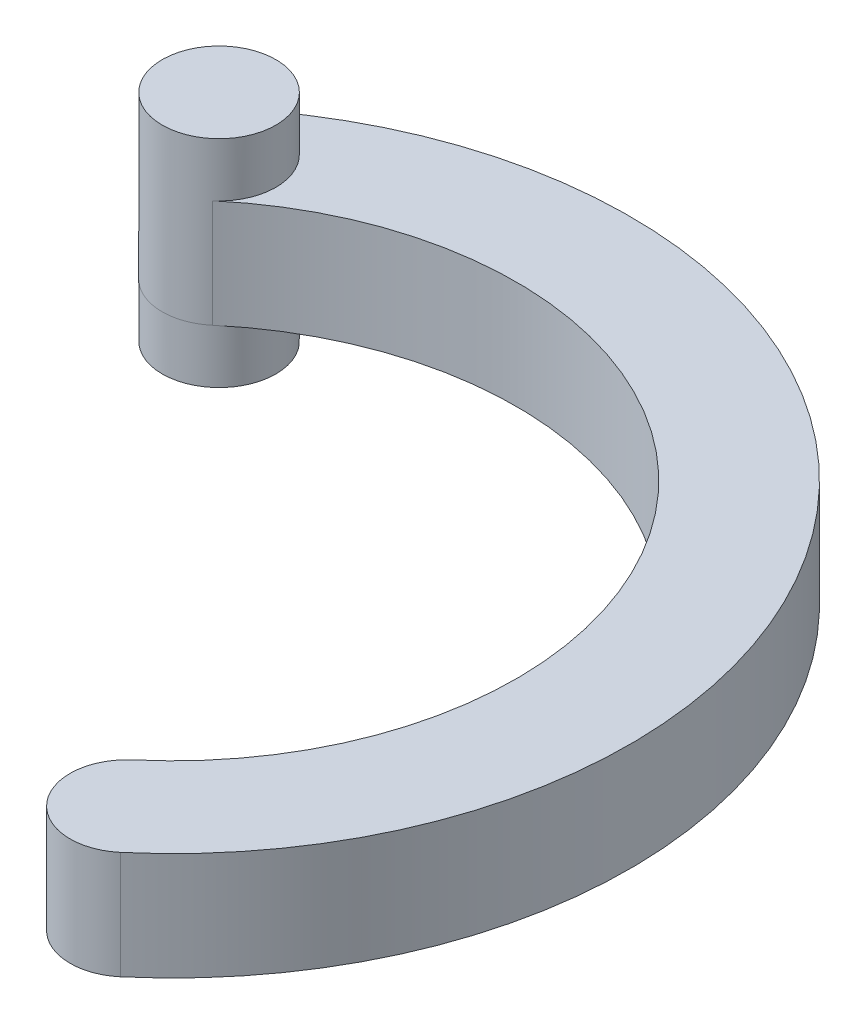
from build123d import *

# Parameters (mm, degrees)
BOSS_EXTRUDE2_DEPTH = 10
SKETCH5_R           = 5.271415538
BOSS_EXTRUDE3_DEPTH = 5
SKETCH8_R           = 5.27
BOSS_EXTRUDE4_DEPTH = 5


with BuildPart() as part:
    # Sketch4 → Boss-Extrude2 (new body)
    with BuildSketch(Plane(origin=(0, 0, 0), x_dir=(1, 0, 0), z_dir=(0, 1, 0))):
        with BuildLine():
            ThreePointArc((51.493202039, -60.650498275), (56.375212409, -0.863559663), (-3.411726203, 4.018450707))
            ThreePointArc((-3.411726203, 4.018450707), (-4.018450707, -3.411726203), (3.411726203, -4.018450707))
            ThreePointArc((3.411726203, -4.018450707), (48.338310994, -7.687012068), (44.669749634, -52.61359686))
            ThreePointArc((44.669749634, -52.61359686), (44.063025129, -60.04377377), (51.493202039, -60.650498275))
        make_face()
    extrude(amount=BOSS_EXTRUDE2_DEPTH)

    # Sketch5 → Boss-Extrude3 (add)
    with BuildSketch(Plane(origin=(0, 10, 0), x_dir=(1, 0, 0), z_dir=(0, 1, 0))):
        with Locations(Location((0, 0, 0), (0, 0, 130.331767004))):
            Circle(SKETCH5_R)
    extrude(amount=BOSS_EXTRUDE3_DEPTH)

    # Sketch8 → Boss-Extrude4 (add)
    with BuildSketch(Plane.XZ):
        with Locations(Location((0, 0, 0), (0, 0, 90))):
            Circle(SKETCH8_R)
    extrude(amount=BOSS_EXTRUDE4_DEPTH)


solid = part.part
